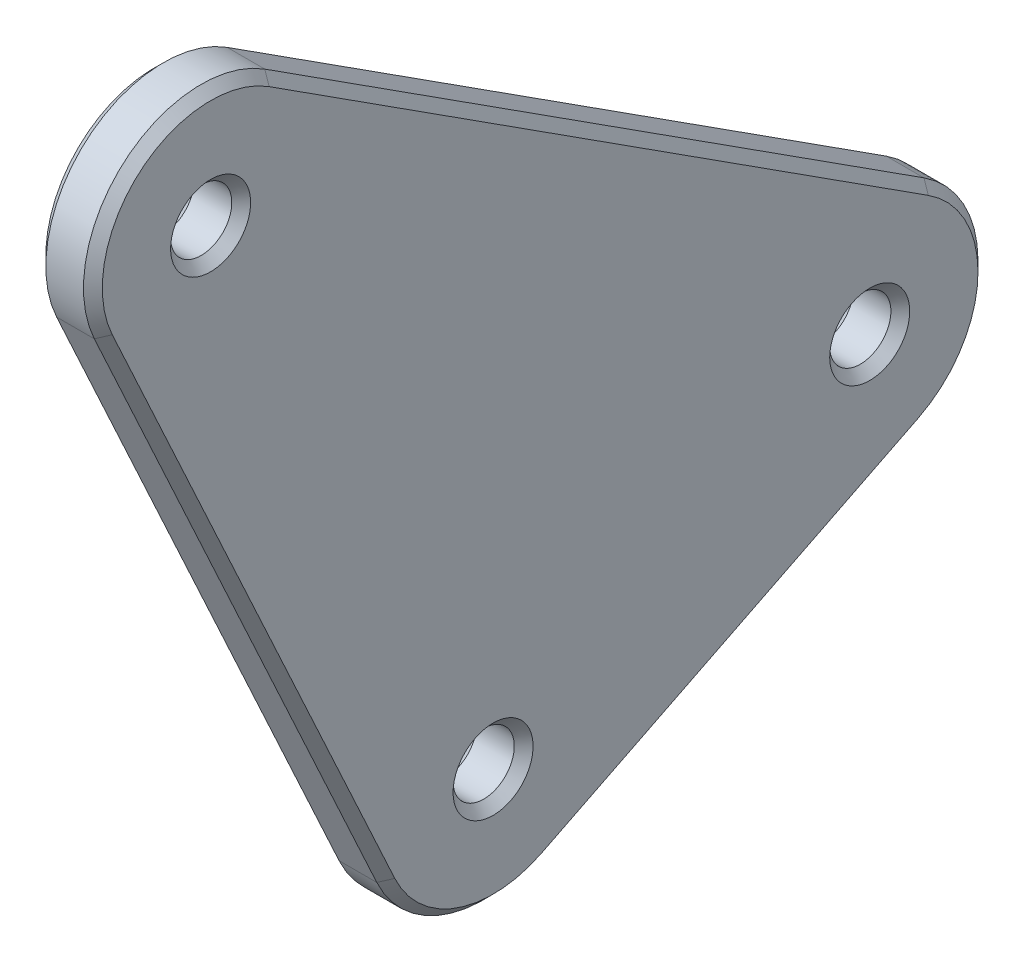
from build123d import *

# Parameters (mm, degrees)
SKETCH_1_R          = 1.625
EXTRUDE_1_DEPTH     = 3
CHAMFER_1_SIZE      = 0.5
CUT_EXTRUDE_1_DEPTH = 10
CHAMFER_2_SIZE      = 0.5
EXTRUDE_2_DEPTH     = 3


with BuildPart() as part:
    # 草图1 → 凸台-拉伸1 (new body)
    with BuildSketch(Plane(origin=(-1.5, 0, 0), x_dir=(0, -1, 0), z_dir=(-1, 0, 0))):
        with BuildLine():
            Line((-4.409830069, -22.795084974), (5.590169942, -2.795084974))
            ThreePointArc((5.590169942, -2.795084974), (5.897676995, 2.068793383), (2.619113609, 5.674746153))
            Line((2.619113609, 5.674746153), (-29.880886391, 20.674746153))
            ThreePointArc((-29.880886391, 20.674746153), (-37.215506358, 19.102011676), (-37.757365472, 11.620265055))
            Line((-37.757365472, 11.620265055), (-15.257365483, -23.379734945))
            ThreePointArc((-15.257365483, -23.379734945), (-9.663631759, -26.240941948), (-4.409830069, -22.795084974))
        make_face()
        with Locations(Location((0, 0, 0), (0, 0, 270))):
            Circle(SKETCH_1_R, mode=Mode.SUBTRACT)
        with Locations(Location((-32.5, 15, 0), (0, 0, 270))):
            Circle(SKETCH_1_R, mode=Mode.SUBTRACT)
        with Locations(Location((-10.000000011, -20, 0), (0, 0, 270))):
            Circle(SKETCH_1_R, mode=Mode.SUBTRACT)
        with BuildLine():
            Line((-25.696229087, 9.501814319), (-12.177289309, -11.527647568))
            ThreePointArc((-12.177289309, -11.527647568), (-12.703025857, -13.946035685), (-15.121413973, -13.420299137))
            Line((-15.121413973, -13.420299137), (-28.640353751, 7.60916275))
            ThreePointArc((-28.640353751, 7.60916275), (-28.114617204, 10.027550867), (-25.696229087, 9.501814319))
        make_face(mode=Mode.SUBTRACT)
        with BuildLine():
            Line((-15.542003206, 7.113468289), (-6.078745362, -7.607155033))
            ThreePointArc((-6.078745362, -7.607155033), (-6.604481909, -10.025543149), (-9.022870026, -9.499806601))
            Line((-9.022870026, -9.499806601), (-18.48612787, 5.22081672))
            ThreePointArc((-18.48612787, 5.22081672), (-17.960391323, 7.639204836), (-15.542003206, 7.113468289))
        make_face(mode=Mode.SUBTRACT)
    extrude(amount=-EXTRUDE_1_DEPTH)

    # 倒角1
    chamfer_1_edges = [part.edges().sort_by_distance(p)[0] for p in [
        (1.5, -5.897676995, 2.068793383),
        (1.5, 13.630886391, 13.174746153),
        (1.5, 0, 1.625),
        (-1.5, 0, 1.625),
        (1.5, 32.5, 16.625),
        (1.5, 37.215506358, 19.102011676),
        (-1.5, 32.5, 16.625),
        (1.5, 10.000000011, -18.375),
        (1.5, 26.507365477, -5.879734945),
        (-1.5, 10.000000011, -18.375),
        (1.5, 28.114617204, 10.027550867),
        (1.5, 18.936759198, -1.012916624),
        (1.5, 12.703025857, -13.946035685),
        (1.5, 21.880883862, -2.905568193),
        (-1.5, 28.114617204, 10.027550867),
        (-1.5, 21.880883862, -2.905568193),
        (-1.5, 12.703025857, -13.946035685),
        (-1.5, 18.936759198, -1.012916624),
        (1.5, 17.960391323, 7.639204836),
        (1.5, 10.810374284, -0.246843372),
        (1.5, 6.604481909, -10.025543149),
        (1.5, 13.754498948, -2.139494941),
        (-1.5, 17.960391323, 7.639204836),
        (-1.5, 13.754498948, -2.139494941),
        (-1.5, 6.604481909, -10.025543149),
        (-1.5, 10.810374284, -0.246843372),
        (1.5, 9.663631759, -26.240941948),
        (-1.5, 26.507365477, -5.879734945),
        (-1.5, 37.215506358, 19.102011676),
        (-1.5, 13.630886391, 13.174746153),
        (-1.5, -5.897676995, 2.068793383),
        (-1.5, -0.590169937, -12.795084974),
        (-1.5, 9.663631759, -26.240941948),
        (1.5, -0.590169937, -12.795084974),
    ]]
    chamfer(chamfer_1_edges, length=CHAMFER_1_SIZE)

    # 草图2 → 切除-拉伸1 (cut)
    with BuildSketch(Plane(origin=(1.5, 0, 0), x_dir=(0, 0, -1), z_dir=(1, 0, 0))):
        with BuildLine():
            Line((-3.928015544, 10.805893754), (0.277876833, 8.102105799))
            ThreePointArc((0.277876833, 8.102105799), (0.803613381, 5.683717682), (-1.614774736, 5.157981135))
            Line((-1.614774736, 5.157981135), (-5.820667113, 7.86176909))
            ThreePointArc((-5.820667113, 7.86176909), (-6.346403661, 10.280157207), (-3.928015544, 10.805893754))
        make_face()
    extrude(amount=-CUT_EXTRUDE_1_DEPTH, mode=Mode.SUBTRACT)

    # 倒角2
    chamfer_2_edges = [part.edges().sort_by_distance(p)[0] for p in [
        (-1.5, 5.683717682, -0.803613381),
        (-1.5, 9.453999777, 1.825069356),
        (-1.5, 10.280157207, 6.346403661),
        (-1.5, 6.509875112, 3.717720925),
        (1.5, 9.453999777, 1.825069356),
        (1.5, 6.509875112, 3.717720925),
        (1.5, 5.683717682, -0.803613381),
        (1.5, 10.280157207, 6.346403661),
    ]]
    chamfer(chamfer_2_edges, length=CHAMFER_2_SIZE)

    # Sketch 3D_1 → 凸台-拉伸2 (add)
    with BuildSketch(Plane(origin=(1.5, 33.431032362, 9.779789625), x_dir=(0, -0.8679628670019027, -0.49662909852911097), z_dir=(1, 0, 0))):
        Polygon((0, 0), (27.366404933, 14.397799707), (33.391580963, 10.950327639), (36.801934048, 0), (32.111357291, -5.715828848), (26.004298505, -10.99963533), (16.146301167, -10.675777123), (2.885850361, -3.94968319), align=None)
    extrude(amount=-EXTRUDE_2_DEPTH)


solid = part.part
